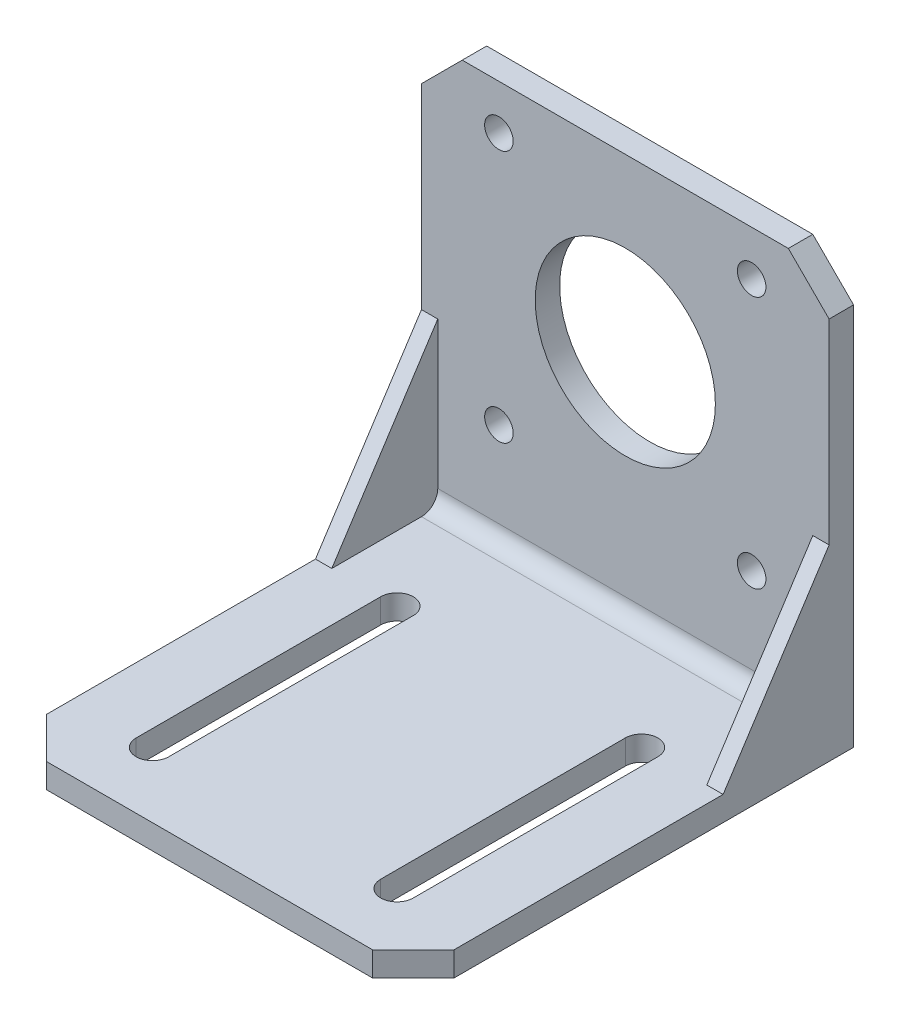
from build123d import *

# Parameters (mm, degrees)
SKETCH_1_R      = 11.05
SKETCH_1_R_2    = 1.75
EXTRUDE_1_DEPTH = 3
EXTRUDE_2_DEPTH = 3
RIB_1_REACH     = 79.859
SKETCH_3_WALL_W = 181.571414162
SKETCH_3_WALL_H = 2
FILLET_1_R      = 2


with BuildPart() as part:
    # 草图1 → 凸台-拉伸1 (new body)
    with BuildSketch(Plane.XY):
        Polygon((-20, 21), (20, 21), (25, 16), (25, -28), (-25, -28), (-25, 16), align=None)
        Circle(SKETCH_1_R, mode=Mode.SUBTRACT)
        with Locations((15.5, 15.5)):
            Circle(SKETCH_1_R_2, mode=Mode.SUBTRACT)
        with Locations((15.5, -15.5)):
            Circle(SKETCH_1_R_2, mode=Mode.SUBTRACT)
        with Locations(Location((-15.5, -15.5, 0), (0, 0, 180))):
            Circle(SKETCH_1_R_2, mode=Mode.SUBTRACT)
        with Locations(Location((-15.5, 15.5, 0), (0, 0, 180))):
            Circle(SKETCH_1_R_2, mode=Mode.SUBTRACT)
    extrude(amount=-EXTRUDE_1_DEPTH)

    # 草图2 → 凸台-拉伸2 (add)
    with BuildSketch(Plane.XZ.offset(28)):
        Polygon((-25, -3), (-25, 46), (-20, 51), (20, 51), (25, 46), (25, -3), align=None)
        with BuildLine():
            Line((-13, 43), (-13, 13))
            ThreePointArc((-13, 13), (-15, 11), (-17, 13))
            Line((-17, 13), (-17, 43))
            ThreePointArc((-17, 43), (-15, 45), (-13, 43))
        make_face(mode=Mode.SUBTRACT)
        with BuildLine():
            Line((13, 43), (13, 13))
            ThreePointArc((13, 13), (15, 11), (17, 13))
            Line((17, 13), (17, 43))
            ThreePointArc((17, 43), (15, 45), (13, 43))
        make_face(mode=Mode.SUBTRACT)
    extrude(amount=EXTRUDE_2_DEPTH)

    # 草图3 wall → 筋1 (add, up to next)
    with BuildSketch(Plane(origin=(-25, -18, 6.5), x_dir=(0, -0.838443616301, 0.544988350595), z_dir=(0, 0.544988350595, 0.838443616301)), mode=Mode.PRIVATE) as rib_1_sk1:
        with Locations((0, 1)):
            Rectangle(SKETCH_3_WALL_W, SKETCH_3_WALL_H)
    rib_1_tool1 = extrude(rib_1_sk1.sketch, amount=-RIB_1_REACH, mode=Mode.PRIVATE) - part.part
    rib_1 = rib_1_tool1.solids().sort_by_distance((-25, -18, 6.5))[0]
    add(rib_1)

    # 镜向1: 筋1 across plane
    add(rib_1.mirror(Plane(origin=(0, 0, 0), x_dir=(0, 0, 1), z_dir=(1, 0, 0))))

    # 圆角1
    fillet_1_edges = [part.edges().sort_by_distance(p)[0] for p in [
        (0, -28, 0),
    ]]
    fillet(fillet_1_edges, radius=FILLET_1_R)


solid = part.part
